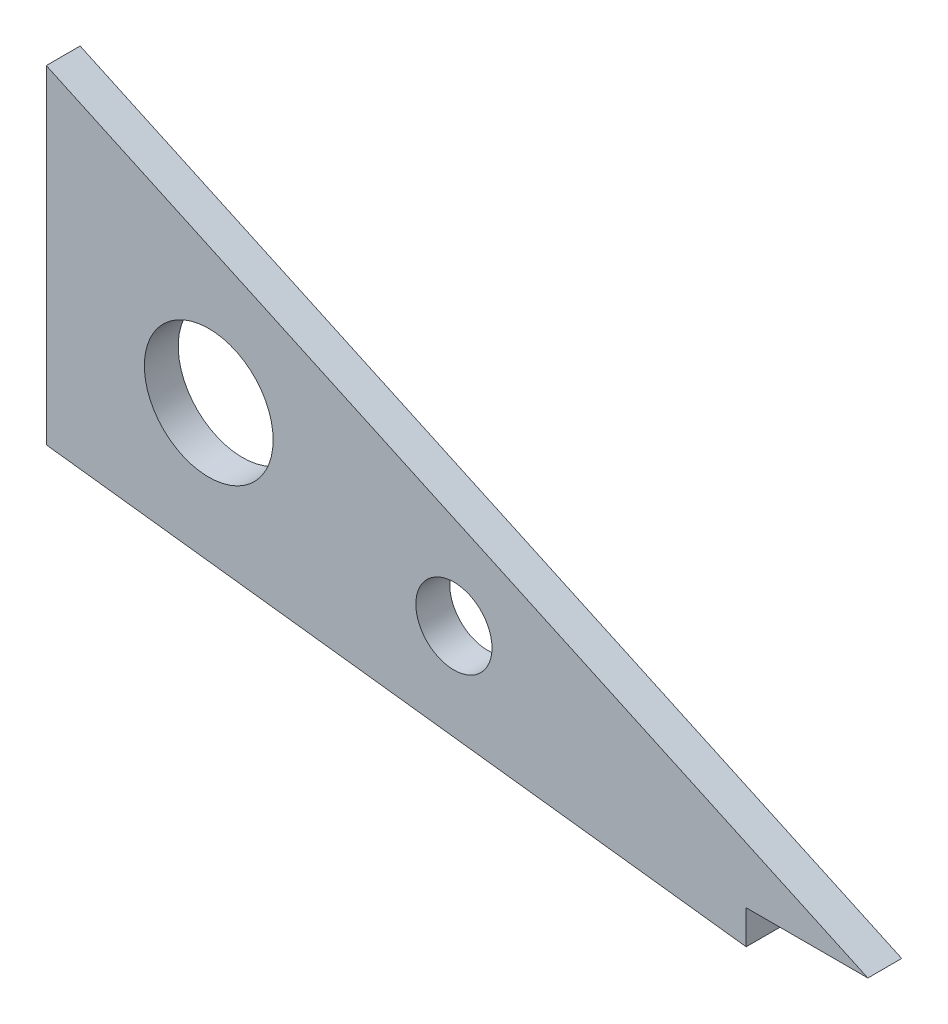
from build123d import *

# Parameters (mm, degrees)
MODEL_R         = 3.804230181
MODEL_R_2       = 2.249925634
EXTRUDE_1_DEPTH = 2


with BuildPart() as part:
    # Model → 凸台-拉伸1 (new body)
    with BuildSketch(Plane.XY):
        Polygon((18.381222318, 35.362593606), (18.381222318, 15.959893606), (59.723057506, 10.950493606), (59.723057506, 12.950493606), (66.912557506, 12.950493606), align=None)
        with Locations((27.978555101, 22.907063291)):
            Circle(MODEL_R, mode=Mode.SUBTRACT)
        with Locations((42.460272902, 18.729803789)):
            Circle(MODEL_R_2, mode=Mode.SUBTRACT)
    extrude(amount=EXTRUDE_1_DEPTH)


solid = part.part
